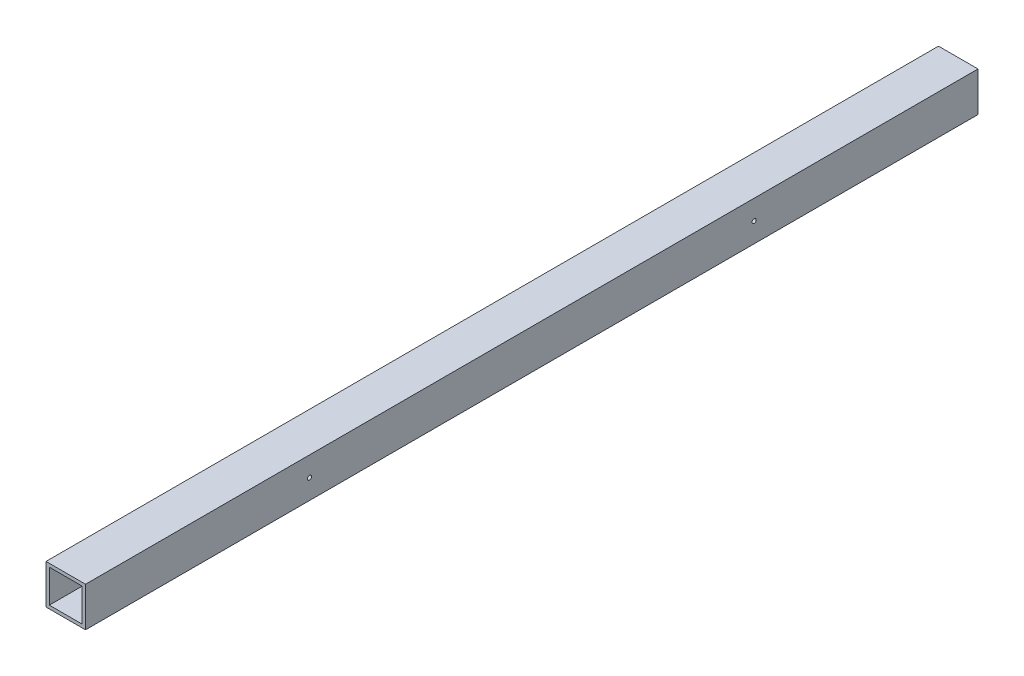
from build123d import *

# Parameters (mm, degrees)
SKETCH_1_W         = 24
SKETCH_1_H         = 24
SKETCH_1_W_2       = 20
SKETCH_1_H_2       = 20
EXTRUDE_1_DEPTH    = 271
HOLE_WIZARD_M3_3_D = 2.5


with BuildPart() as part:
    # 草图1 → 凸台-拉伸1 (new, symmetric)
    with BuildSketch(Plane.XY):
        Rectangle(SKETCH_1_W, SKETCH_1_H)
        Rectangle(SKETCH_1_W_2, SKETCH_1_H_2, mode=Mode.SUBTRACT)
    extrude(amount=EXTRUDE_1_DEPTH, both=True)

    # M3 螺纹孔的螺纹孔钻头3 (through all)
    with Locations(Plane(origin=(-12, 0, -135), x_dir=(0, -1, 0), z_dir=(-1, 0, 0))):
        with Locations((0, 0)):
            hole_wizard_m3_3 = Hole(HOLE_WIZARD_M3_3_D / 2)

    # 镜向1: M3 螺纹孔的螺纹孔钻头3 across plane
    add(hole_wizard_m3_3.mirror(Plane.XY), mode=Mode.SUBTRACT)


solid = part.part
